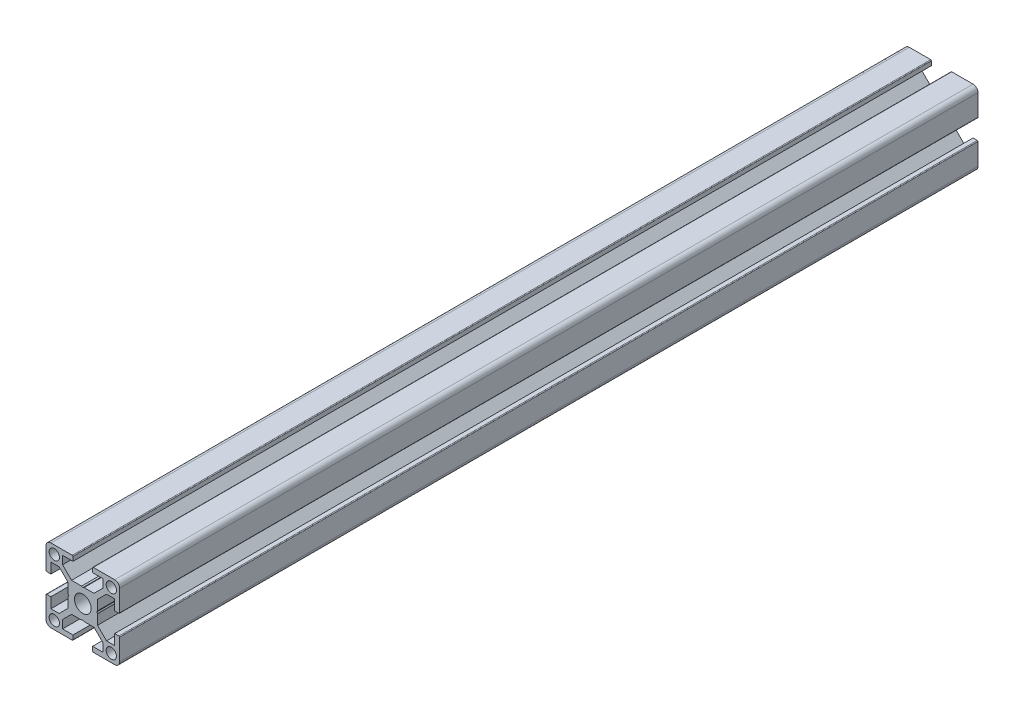
from build123d import *

# Parameters (mm, degrees)
SKETCH1_R           = 2.1
SKETCH1_R_2         = 3.4
BOSS_EXTRUDE1_DEPTH = 350


with BuildPart() as part:
    # Sketch1 → Boss-Extrude1 (new body)
    with BuildSketch(Plane.XY):
        with BuildLine():
            Line((-14.7, 4), (-13, 4))
            Line((-13, 4), (-13, 8.25))
            Line((-13, 8.25), (-9.664213562, 8.25))
            Line((-9.664213562, 8.25), (-6, 4.585786438))
            Line((-6, 4.585786438), (-6, 0.519615242))
            Line((-6, 0.519615242), (-5.7, 0))
            Line((-5.7, 0), (-6, -0.519615242))
            Line((-6, -0.519615242), (-6, -4.585786438))
            Line((-6, -4.585786438), (-9.664213562, -8.25))
            Line((-9.664213562, -8.25), (-13, -8.25))
            Line((-13, -8.25), (-13, -4))
            Line((-13, -4), (-14.7, -4))
            ThreePointArc((-14.7, -4), (-14.912132034, -4.087867966), (-15, -4.3))
            Line((-15, -4.3), (-15, -13))
            ThreePointArc((-15, -13), (-14.414213562, -14.414213562), (-13, -15))
            Line((-13, -15), (-4.3, -15))
            ThreePointArc((-4.3, -15), (-4.087867966, -14.912132034), (-4, -14.7))
            Line((-4, -14.7), (-4, -13))
            Line((-4, -13), (-8.25, -13))
            Line((-8.25, -13), (-8.25, -9.664213562))
            Line((-8.25, -9.664213562), (-4.585786438, -6))
            Line((-4.585786438, -6), (-0.519615242, -6))
            Line((-0.519615242, -6), (0, -5.7))
            Line((0, -5.7), (0.519615242, -6))
            Line((0.519615242, -6), (4.585786438, -6))
            Line((4.585786438, -6), (8.25, -9.664213562))
            Line((8.25, -9.664213562), (8.25, -13))
            Line((8.25, -13), (4, -13))
            Line((4, -13), (4, -14.7))
            ThreePointArc((4, -14.7), (4.087867966, -14.912132034), (4.3, -15))
            Line((4.3, -15), (13, -15))
            ThreePointArc((13, -15), (14.414213562, -14.414213562), (15, -13))
            Line((15, -13), (15, -4.3))
            ThreePointArc((15, -4.3), (14.912132034, -4.087867966), (14.7, -4))
            Line((14.7, -4), (13, -4))
            Line((13, -4), (13, -8.25))
            Line((13, -8.25), (9.664213562, -8.25))
            Line((9.664213562, -8.25), (6, -4.585786438))
            Line((6, -4.585786438), (6, -0.519615242))
            Line((6, -0.519615242), (5.7, 0))
            Line((5.7, 0), (6, 0.519615242))
            Line((6, 0.519615242), (6, 4.585786438))
            Line((6, 4.585786438), (9.664213562, 8.25))
            Line((9.664213562, 8.25), (13, 8.25))
            Line((13, 8.25), (13, 4))
            Line((13, 4), (14.7, 4))
            ThreePointArc((14.7, 4), (14.912132034, 4.087867966), (15, 4.3))
            Line((15, 4.3), (15, 13))
            ThreePointArc((15, 13), (14.414213562, 14.414213562), (13, 15))
            Line((13, 15), (4.3, 15))
            ThreePointArc((4.3, 15), (4.087867966, 14.912132034), (4, 14.7))
            Line((4, 14.7), (4, 13))
            Line((4, 13), (8.25, 13))
            Line((8.25, 13), (8.25, 9.664213562))
            Line((8.25, 9.664213562), (4.585786438, 6))
            Line((4.585786438, 6), (0.519615242, 6))
            Line((0.519615242, 6), (0, 5.7))
            Line((0, 5.7), (-0.519615242, 6))
            Line((-0.519615242, 6), (-4.585786438, 6))
            Line((-4.585786438, 6), (-8.25, 9.664213562))
            Line((-8.25, 9.664213562), (-8.25, 13))
            Line((-8.25, 13), (-4, 13))
            Line((-4, 13), (-4, 14.7))
            ThreePointArc((-4, 14.7), (-4.087867966, 14.912132034), (-4.3, 15))
            Line((-4.3, 15), (-13, 15))
            ThreePointArc((-13, 15), (-14.414213562, 14.414213562), (-15, 13))
            Line((-15, 13), (-15, 4.3))
            ThreePointArc((-15, 4.3), (-14.912132034, 4.087867966), (-14.7, 4))
        make_face()
        with Locations((11.625, 11.625)):
            Circle(SKETCH1_R, mode=Mode.SUBTRACT)
        with Locations((11.625, -11.625)):
            Circle(SKETCH1_R, mode=Mode.SUBTRACT)
        Circle(SKETCH1_R_2, mode=Mode.SUBTRACT)
        with Locations((-11.625, -11.625)):
            Circle(SKETCH1_R, mode=Mode.SUBTRACT)
        with Locations((-11.625, 11.625)):
            Circle(SKETCH1_R, mode=Mode.SUBTRACT)
    extrude(amount=BOSS_EXTRUDE1_DEPTH)


solid = part.part
